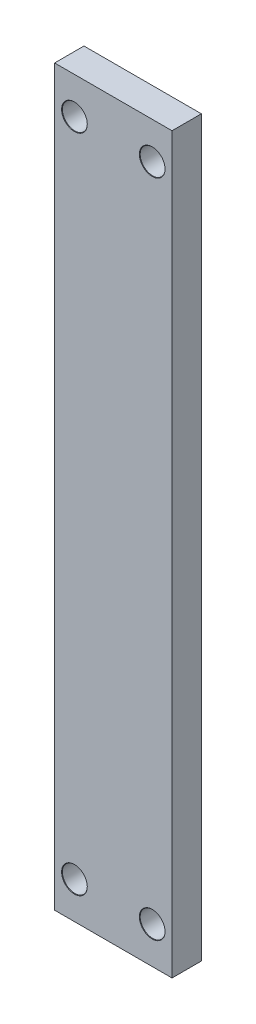
from build123d import *

# Parameters (mm, degrees)
CROQUIS1_W                               = 8
CROQUIS1_H                               = 50
SALIENTE_EXTRUIR1_DEPTH                  = 2
TALADRO_DE_MARGEN_PARA_M1_61_D           = 1.7
TALADRO_DE_MARGEN_PARA_M1_61_CSINK_D     = 1.75
TALADRO_DE_MARGEN_PARA_M1_61_CSINK_ANGLE = 82
TALADRO_DE_MARGEN_PARA_M1_62_D           = 1.7
TALADRO_DE_MARGEN_PARA_M1_62_CSINK_D     = 1.75
TALADRO_DE_MARGEN_PARA_M1_62_CSINK_ANGLE = 82


with BuildPart() as part:
    # Croquis1 → Saliente-Extruir1 (new body)
    with BuildSketch(Plane.XY):
        with Locations((4, 25)):
            Rectangle(CROQUIS1_W, CROQUIS1_H)
    extrude(amount=SALIENTE_EXTRUIR1_DEPTH)

    # Taladro de margen para M1.61 (through all)
    with Locations(Plane.XY.offset(2)):
        with Locations((1.35, 47.5), (6.65, 47.5)):
            CounterSinkHole(TALADRO_DE_MARGEN_PARA_M1_61_D / 2, TALADRO_DE_MARGEN_PARA_M1_61_CSINK_D / 2, counter_sink_angle=TALADRO_DE_MARGEN_PARA_M1_61_CSINK_ANGLE)

    # Taladro de margen para M1.62 (through all)
    with Locations(Plane.XY.offset(2)):
        with Locations((1.35, 2.5), (6.65, 2.5)):
            CounterSinkHole(TALADRO_DE_MARGEN_PARA_M1_62_D / 2, TALADRO_DE_MARGEN_PARA_M1_62_CSINK_D / 2, counter_sink_angle=TALADRO_DE_MARGEN_PARA_M1_62_CSINK_ANGLE)


solid = part.part
